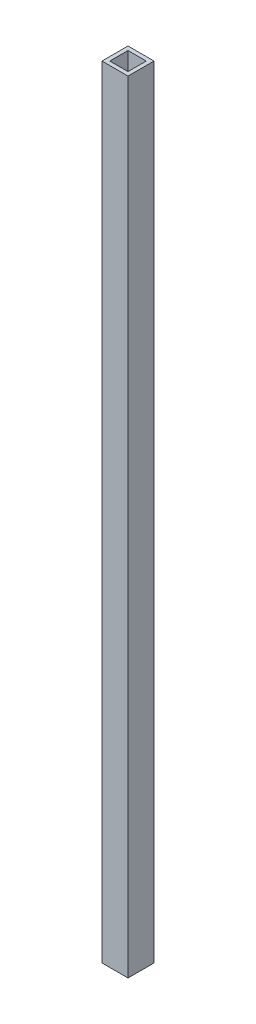
from build123d import *

# Parameters (mm, degrees)
SKETCH1_W           = 10
SKETCH1_H           = 10
SKETCH1_W_2         = 7
SKETCH1_H_2         = 7
BOSS_EXTRUDE1_DEPTH = 300


with BuildPart() as part:
    # Sketch1 → Boss-Extrude1 (new body)
    with BuildSketch(Plane(origin=(0, 0, 0), x_dir=(1, 0, 0), z_dir=(0, 1, 0))):
        Rectangle(SKETCH1_W, SKETCH1_H)
        Rectangle(SKETCH1_W_2, SKETCH1_H_2, mode=Mode.SUBTRACT)
    extrude(amount=BOSS_EXTRUDE1_DEPTH)


solid = part.part
